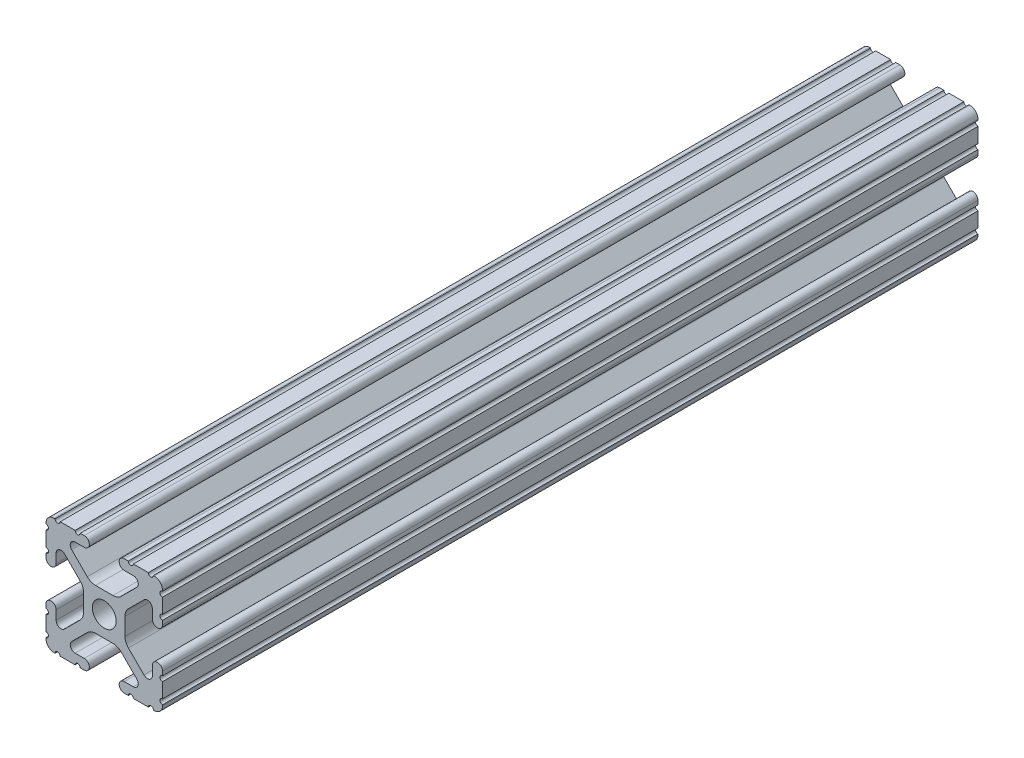
from build123d import *

# Parameters (mm, degrees)
SKETCH3_W           = 25.4
SKETCH3_H           = 25.4
BOSS_EXTRUDE1_DEPTH = 177.8
SKETCH4_R           = 2.6035
CUT_EXTRUDE1_DEPTH  = 179.704840449
CUT_EXTRUDE2_DEPTH  = 179.704840449
FILLET1_R           = 2.54
FILLET2_R           = 1.778


with BuildPart() as part:
    # Sketch3 → Boss-Extrude1 (new body)
    with BuildSketch(Plane.XY):
        Rectangle(SKETCH3_W, SKETCH3_H)
    extrude(amount=BOSS_EXTRUDE1_DEPTH)

    # Sketch4 → Cut-Extrude1 (cut, through all)
    with BuildSketch(Plane.XY.offset(177.8)):
        with BuildLine():
            Line((3.2512, 12.7), (-3.2512, 12.7))
            Line((-3.2512, 12.7), (-3.2512, 10.4902))
            Line((-3.2512, 10.4902), (-6.348478019, 10.4902))
            ThreePointArc((-6.348478019, 10.4902), (-7.335478831, 9.830707141), (-7.103895736, 8.666460301))
            Line((-7.103895736, 8.666460301), (-2.958635435, 4.5212))
            Line((-2.958635435, 4.5212), (2.958635435, 4.5212))
            Line((2.958635435, 4.5212), (7.103895736, 8.666460301))
            ThreePointArc((7.103895736, 8.666460301), (7.335478831, 9.830707141), (6.348478019, 10.4902))
            Line((6.348478019, 10.4902), (3.2512, 10.4902))
            Line((3.2512, 10.4902), (3.2512, 12.7))
        make_face()
        with BuildLine():
            Line((12.7, -3.2512), (12.7, 3.2512))
            Line((12.7, 3.2512), (10.4902, 3.2512))
            Line((10.4902, 3.2512), (10.4902, 6.348478019))
            ThreePointArc((10.4902, 6.348478019), (9.830707141, 7.335478831), (8.666460301, 7.103895736))
            Line((8.666460301, 7.103895736), (4.5212, 2.958635435))
            Line((4.5212, 2.958635435), (4.5212, -2.958635435))
            Line((4.5212, -2.958635435), (8.666460301, -7.103895736))
            ThreePointArc((8.666460301, -7.103895736), (9.830707141, -7.335478831), (10.4902, -6.348478019))
            Line((10.4902, -6.348478019), (10.4902, -3.2512))
            Line((10.4902, -3.2512), (12.7, -3.2512))
        make_face()
        with BuildLine():
            Line((-3.2512, -10.4902), (-3.2512, -12.7))
            Line((-3.2512, -12.7), (3.2512, -12.7))
            Line((3.2512, -12.7), (3.2512, -10.4902))
            Line((3.2512, -10.4902), (6.348478019, -10.4902))
            ThreePointArc((6.348478019, -10.4902), (7.335478831, -9.830707141), (7.103895736, -8.666460301))
            Line((7.103895736, -8.666460301), (2.958635435, -4.5212))
            Line((2.958635435, -4.5212), (-2.958635435, -4.5212))
            Line((-2.958635435, -4.5212), (-7.103895736, -8.666460301))
            ThreePointArc((-7.103895736, -8.666460301), (-7.335478831, -9.830707141), (-6.348478019, -10.4902))
            Line((-6.348478019, -10.4902), (-3.2512, -10.4902))
        make_face()
        with BuildLine():
            Line((-10.4902, 3.2512), (-12.7, 3.2512))
            Line((-12.7, 3.2512), (-12.7, -3.2512))
            Line((-12.7, -3.2512), (-10.4902, -3.2512))
            Line((-10.4902, -3.2512), (-10.4902, -6.348478019))
            ThreePointArc((-10.4902, -6.348478019), (-9.830707141, -7.335478831), (-8.666460301, -7.103895736))
            Line((-8.666460301, -7.103895736), (-4.5212, -2.958635435))
            Line((-4.5212, -2.958635435), (-4.5212, 2.958635435))
            Line((-4.5212, 2.958635435), (-8.666460301, 7.103895736))
            ThreePointArc((-8.666460301, 7.103895736), (-9.830707141, 7.335478831), (-10.4902, 6.348478019))
            Line((-10.4902, 6.348478019), (-10.4902, 3.2512))
        make_face()
        Circle(SKETCH4_R)
    extrude(amount=-CUT_EXTRUDE1_DEPTH, mode=Mode.SUBTRACT)

    # Sketch5 → Cut-Extrude2 (cut, through all)
    with BuildSketch(Plane.XY.offset(177.8)):
        with BuildLine():
            ThreePointArc((-11.5951, 3.2512), (-12.376382283, 3.574817717), (-12.7, 4.3561))
            Line((-12.7, 4.3561), (-12.7, 3.2512))
            Line((-12.7, 3.2512), (-11.5951, 3.2512))
        make_face()
        with BuildLine():
            ThreePointArc((-10.4902, 4.3561), (-10.813817717, 3.574817717), (-11.5951, 3.2512))
            Line((-11.5951, 3.2512), (-10.4902, 3.2512))
            Line((-10.4902, 3.2512), (-10.4902, 4.3561))
        make_face()
        with BuildLine():
            Line((-12.7, -3.2512), (-12.7, -4.3561))
            ThreePointArc((-12.7, -4.3561), (-12.376382283, -3.574817717), (-11.5951, -3.2512))
            Line((-11.5951, -3.2512), (-12.7, -3.2512))
        make_face()
        with BuildLine():
            Line((-10.4902, -3.2512), (-11.5951, -3.2512))
            ThreePointArc((-11.5951, -3.2512), (-10.813817717, -3.574817717), (-10.4902, -4.3561))
            Line((-10.4902, -4.3561), (-10.4902, -3.2512))
        make_face()
        with BuildLine():
            Line((-3.2512, -11.595100007), (-3.2512, -10.4902))
            Line((-3.2512, -10.4902), (-4.3561, -10.4902))
            ThreePointArc((-4.3561, -10.4902), (-3.574817715, -10.81381772), (-3.2512, -11.595100007))
        make_face()
        with BuildLine():
            Line((-3.2512, -12.7), (-3.2512, -11.595100007))
            ThreePointArc((-3.2512, -11.595100007), (-3.57481772, -12.376382285), (-4.3561, -12.7))
            Line((-4.3561, -12.7), (-3.2512, -12.7))
        make_face()
        with BuildLine():
            Line((3.2512, -10.4902), (3.2512, -11.5951))
            ThreePointArc((3.2512, -11.5951), (3.574817718, -10.813817717), (4.3561, -10.4902))
            Line((4.3561, -10.4902), (3.2512, -10.4902))
        make_face()
        with BuildLine():
            Line((3.2512, -12.7), (4.3561, -12.7))
            ThreePointArc((4.3561, -12.7), (3.574817717, -12.376382282), (3.2512, -11.5951))
            Line((3.2512, -11.5951), (3.2512, -12.7))
        make_face()
        with BuildLine():
            Line((11.5951, -3.2512), (10.4902, -3.2512))
            Line((10.4902, -3.2512), (10.4902, -4.3561))
            ThreePointArc((10.4902, -4.3561), (10.813817717, -3.574817717), (11.5951, -3.2512))
        make_face()
        with BuildLine():
            Line((12.7, -3.2512), (11.5951, -3.2512))
            ThreePointArc((11.5951, -3.2512), (12.376382283, -3.574817717), (12.7, -4.3561))
            Line((12.7, -4.3561), (12.7, -3.2512))
        make_face()
        with BuildLine():
            Line((10.4902, 3.2512), (11.5951, 3.2512))
            ThreePointArc((11.5951, 3.2512), (10.813817717, 3.574817717), (10.4902, 4.3561))
            Line((10.4902, 4.3561), (10.4902, 3.2512))
        make_face()
        with BuildLine():
            Line((12.7, 3.2512), (12.7, 4.3561))
            ThreePointArc((12.7, 4.3561), (12.376382283, 3.574817717), (11.5951, 3.2512))
            Line((11.5951, 3.2512), (12.7, 3.2512))
        make_face()
        with BuildLine():
            Line((3.2512, 12.7), (3.2512, 11.595099996))
            ThreePointArc((3.2512, 11.595099996), (3.574817716, 12.376382281), (4.3561, 12.7))
            Line((4.3561, 12.7), (3.2512, 12.7))
        make_face()
        with BuildLine():
            Line((3.2512, 11.595099996), (3.2512, 10.4902))
            Line((3.2512, 10.4902), (4.3561, 10.4902))
            ThreePointArc((4.3561, 10.4902), (3.574817719, 10.813817716), (3.2512, 11.595099996))
        make_face()
        with BuildLine():
            Line((-3.2512, 12.7), (-4.3561, 12.7))
            ThreePointArc((-4.3561, 12.7), (-3.574817717, 12.376382283), (-3.2512, 11.5951))
            Line((-3.2512, 11.5951), (-3.2512, 12.7))
        make_face()
        with BuildLine():
            Line((-3.2512, 10.4902), (-3.2512, 11.5951))
            ThreePointArc((-3.2512, 11.5951), (-3.574817717, 10.813817717), (-4.3561, 10.4902))
            Line((-4.3561, 10.4902), (-3.2512, 10.4902))
        make_face()
        with BuildLine():
            ThreePointArc((-12.7, 5.23875), (-12.14755, 5.7912), (-12.7, 6.34365))
            Line((-12.7, 6.34365), (-12.7, 5.23875))
        make_face()
        with BuildLine():
            ThreePointArc((-12.7, 9.60755), (-12.14755, 10.16), (-12.7, 10.71245))
            Line((-12.7, 10.71245), (-12.7, 9.60755))
        make_face()
        with BuildLine():
            ThreePointArc((-10.71245, 12.7), (-10.16, 12.14755), (-9.60755, 12.7))
            Line((-9.60755, 12.7), (-10.71245, 12.7))
        make_face()
        with BuildLine():
            ThreePointArc((-6.34365, 12.7), (-5.7912, 12.14755), (-5.23875, 12.7))
            Line((-5.23875, 12.7), (-6.34365, 12.7))
        make_face()
        with BuildLine():
            Line((6.34365, 12.7), (5.23875, 12.7))
            ThreePointArc((5.23875, 12.7), (5.7912, 12.14755), (6.34365, 12.7))
        make_face()
        with BuildLine():
            Line((10.71245, 12.7), (9.60755, 12.7))
            ThreePointArc((9.60755, 12.7), (10.16, 12.14755), (10.71245, 12.7))
        make_face()
        with BuildLine():
            Line((12.7, 10.71245), (12.7, 9.60755))
            ThreePointArc((12.7, 9.60755), (12.14755, 10.16), (12.7, 10.71245))
        make_face()
        with BuildLine():
            Line((12.7, 6.34365), (12.7, 5.23875))
            ThreePointArc((12.7, 5.23875), (12.14755, 5.7912), (12.7, 6.34365))
        make_face()
        with BuildLine():
            Line((-12.7, -6.34365), (-12.7, -5.23875))
            ThreePointArc((-12.7, -5.23875), (-12.14755, -5.7912), (-12.7, -6.34365))
        make_face()
        with BuildLine():
            Line((-12.7, -10.71245), (-12.7, -9.60755))
            ThreePointArc((-12.7, -9.60755), (-12.14755, -10.16), (-12.7, -10.71245))
        make_face()
        with BuildLine():
            Line((-10.71245, -12.7), (-9.60755, -12.7))
            ThreePointArc((-9.60755, -12.7), (-10.16, -12.14755), (-10.71245, -12.7))
        make_face()
        with BuildLine():
            Line((-6.34365, -12.7), (-5.23875, -12.7))
            ThreePointArc((-5.23875, -12.7), (-5.7912, -12.14755), (-6.34365, -12.7))
        make_face()
        with BuildLine():
            Line((12.7, -10.71245), (12.7, -9.60755))
            ThreePointArc((12.7, -9.60755), (12.14755, -10.16), (12.7, -10.71245))
        make_face()
        with BuildLine():
            Line((12.7, -6.34365), (12.7, -5.23875))
            ThreePointArc((12.7, -5.23875), (12.14755, -5.7912), (12.7, -6.34365))
        make_face()
        with BuildLine():
            Line((10.71245, -12.7), (9.60755, -12.7))
            ThreePointArc((9.60755, -12.7), (10.16, -12.14755), (10.71245, -12.7))
        make_face()
        with BuildLine():
            Line((6.34365, -12.7), (5.23875, -12.7))
            ThreePointArc((5.23875, -12.7), (5.7912, -12.14755), (6.34365, -12.7))
        make_face()
    extrude(amount=-CUT_EXTRUDE2_DEPTH, mode=Mode.SUBTRACT)

    # Fillet1
    fillet1_edges = [part.edges().sort_by_distance(p)[0] for p in [
        (-2.958635435, -4.5212, 88.9),
        (2.958635435, -4.5212, 88.9),
        (4.5212, -2.958635435, 88.9),
        (4.5212, 2.958635435, 88.9),
        (-4.5212, 2.958635435, 88.9),
        (-4.5212, -2.958635435, 88.9),
        (2.958635435, 4.5212, 88.9),
        (-2.958635435, 4.5212, 88.9),
    ]]
    fillet(fillet1_edges, radius=FILLET1_R)

    # Fillet2
    fillet2_edges = [part.edges().sort_by_distance(p)[0] for p in [
        (-12.7, 12.7, 88.9),
        (12.7, 12.7, 88.9),
        (12.7, -12.7, 88.9),
        (-12.7, -12.7, 88.9),
    ]]
    fillet(fillet2_edges, radius=FILLET2_R)


solid = part.part
